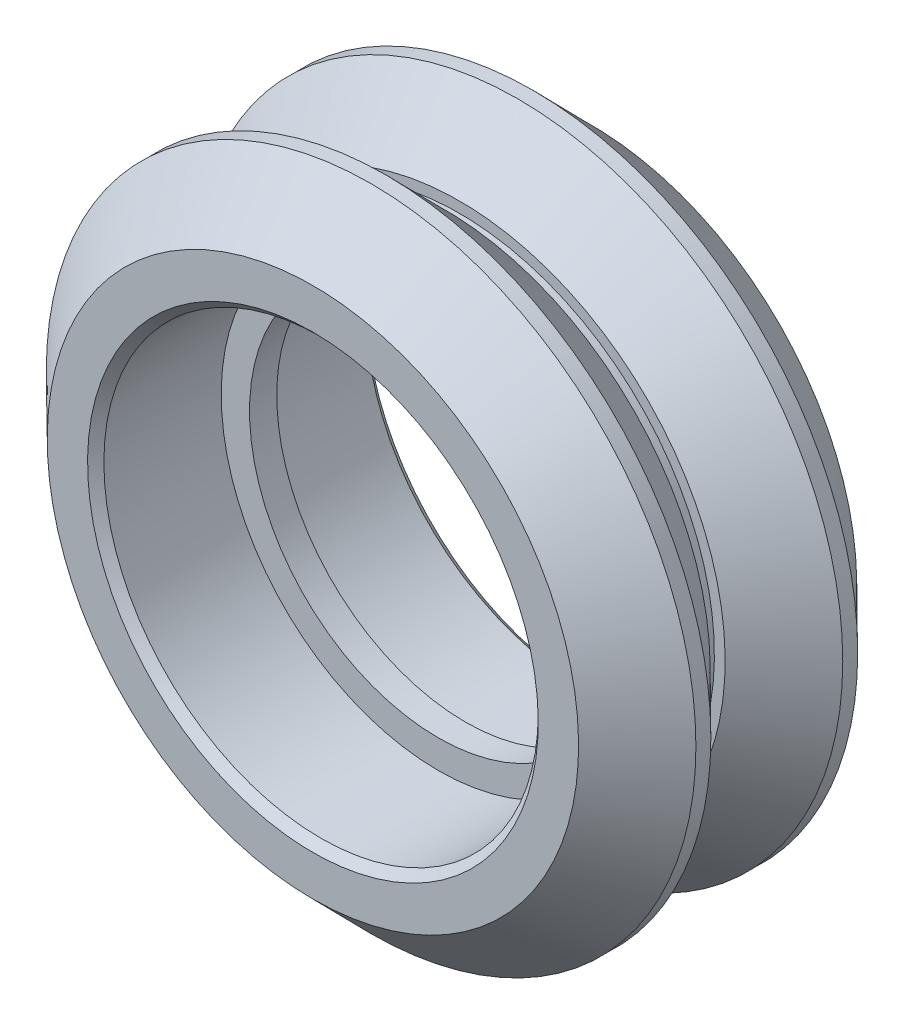
from build123d import *

# Parameters (mm, degrees)
CHAMFER1_SIZE = 0.3


with BuildPart() as part:
    # Sketch1 → Revolve1 (revolve)
    with BuildSketch(Plane(origin=(0, 0, 0), x_dir=(0, 0, -1), z_dir=(1, 0, 0)), mode=Mode.PRIVATE) as revolve1_sk:
        Polygon((-2.975, 11.945), (-2.425, 11.945), (-0.275, 9.77), (-0.275, 9.375), (0.275, 9.375), (0.275, 9.77), (2.425, 11.945), (2.975, 11.945), (5.115, 9.77), (5.115, 7.987), (0.5, 7.987), (0.5, 6.945), (-0.5, 6.945), (-0.5, 7.987), (-5.115, 7.987), (-5.115, 9.77), align=None)
    revolve(revolve1_sk.sketch.rotate(Axis((0, 0, 5.115), (0, 0, -1)), 180), axis=Axis((0, 0, 5.115), (0, 0, -1)))

    # Chamfer1
    chamfer1_edges = [part.edges().sort_by_distance(p)[0] for p in [
        (0, 7.987, -5.115),
        (0, 7.987, 5.115),
    ]]
    chamfer(chamfer1_edges, length=CHAMFER1_SIZE)


solid = part.part
